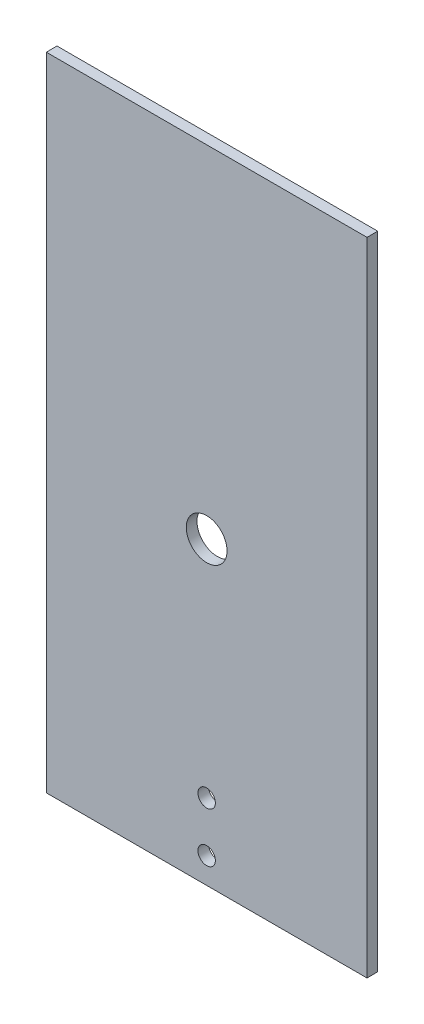
from build123d import *

# Parameters (mm, degrees)
SKETCH1_W                 = 60
SKETCH1_H                 = 120
BOSS_EXTRUDE1_DEPTH       = 2
SKETCH2_R                 = 3.814375117
CUT_EXTRUDE1_DEPTH        = 2
F_4_CLEARANCE_HOLE2_D     = 3.2639
F_4_CLEARANCE_HOLE2_DEPTH = 10
F_4_CLEARANCE_HOLE2_TIP   = 0.980574487


with BuildPart() as part:
    # Sketch1 → Boss-Extrude1 (new body)
    with BuildSketch(Plane.XY):
        with Locations((0, 79.160593828)):
            Rectangle(SKETCH1_W, SKETCH1_H)
    extrude(amount=BOSS_EXTRUDE1_DEPTH)

    # Sketch2 → Cut-Extrude1 (cut)
    with BuildSketch(Plane(origin=(0, 0, 0), x_dir=(-1, 0, 0), z_dir=(0, 0, -1))):
        with Locations((0, 75.261)):
            Circle(SKETCH2_R)
    extrude(amount=-CUT_EXTRUDE1_DEPTH, mode=Mode.SUBTRACT)

    # #4 Clearance Hole2
    with Locations(Plane.XY.offset(2)):
        with Locations((0, 33.332), (0, 23.992)):
            Hole(F_4_CLEARANCE_HOLE2_D / 2, depth=F_4_CLEARANCE_HOLE2_DEPTH)
            with Locations((0, 0, -(F_4_CLEARANCE_HOLE2_DEPTH + F_4_CLEARANCE_HOLE2_TIP / 2))):  # 118° drill point
                Cone(0, F_4_CLEARANCE_HOLE2_D / 2, F_4_CLEARANCE_HOLE2_TIP, mode=Mode.SUBTRACT)


solid = part.part
